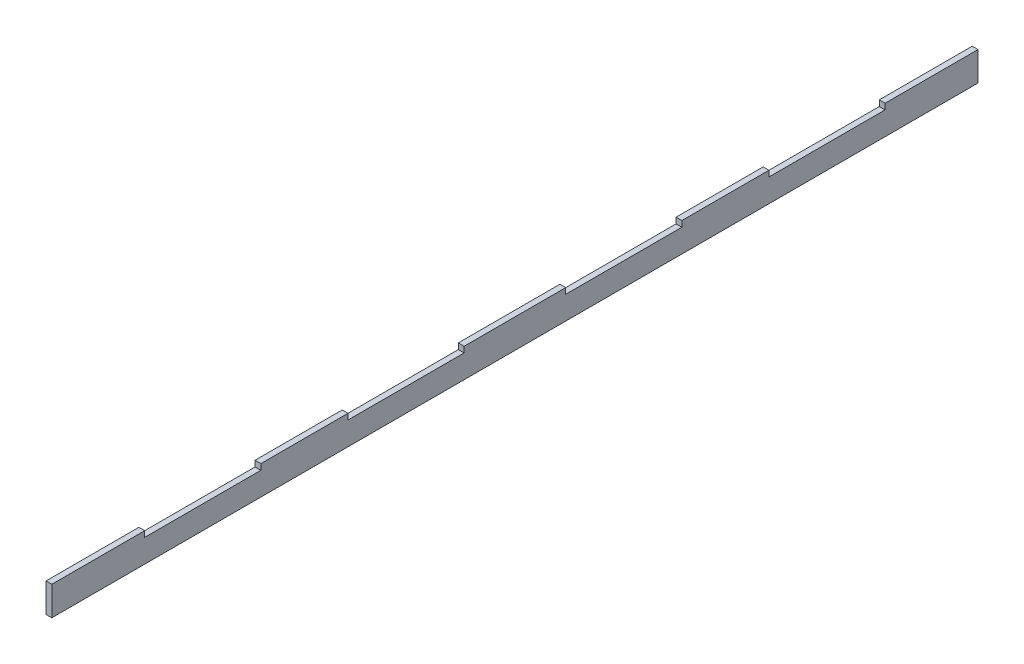
from build123d import *

# Parameters (mm, degrees)
SKETCH1_W               = 319
SKETCH1_H               = 10
BOSS_EXTRUDE1_DEPTH     = 2
CUT_EXTRUDE1_DEPTH      = 160.590883198
CUT_EXTRUDE1_DEPTH_BACK = 160.590883198
SKETCH2_W               = 40
SKETCH2_H               = 2


with BuildPart() as part:
    # Sketch1 → Boss-Extrude1 (new body)
    with BuildSketch(Plane(origin=(0, 0, 0), x_dir=(0, 0, -1), z_dir=(1, 0, 0))):
        Rectangle(SKETCH1_W, SKETCH1_H)
    extrude(amount=BOSS_EXTRUDE1_DEPTH)

    # Sketch2 → Cut-Extrude1 (cut, two sides: drawn at the far end of the back side and taken through both)
    with BuildSketch(Plane(origin=(2, 0, 0), x_dir=(0, 0, -1), z_dir=(1, 0, 0)).offset(-CUT_EXTRUDE1_DEPTH_BACK)):
        with Locations((-107.5, 4)):
            Rectangle(SKETCH2_W, SKETCH2_H)
        with Locations((-37.5, 4)):
            Rectangle(SKETCH2_W, SKETCH2_H)
        with Locations((37.5, 4)):
            Rectangle(SKETCH2_W, SKETCH2_H)
        with Locations((107.5, 4)):
            Rectangle(SKETCH2_W, SKETCH2_H)
    extrude(amount=CUT_EXTRUDE1_DEPTH + CUT_EXTRUDE1_DEPTH_BACK, mode=Mode.SUBTRACT)


solid = part.part
